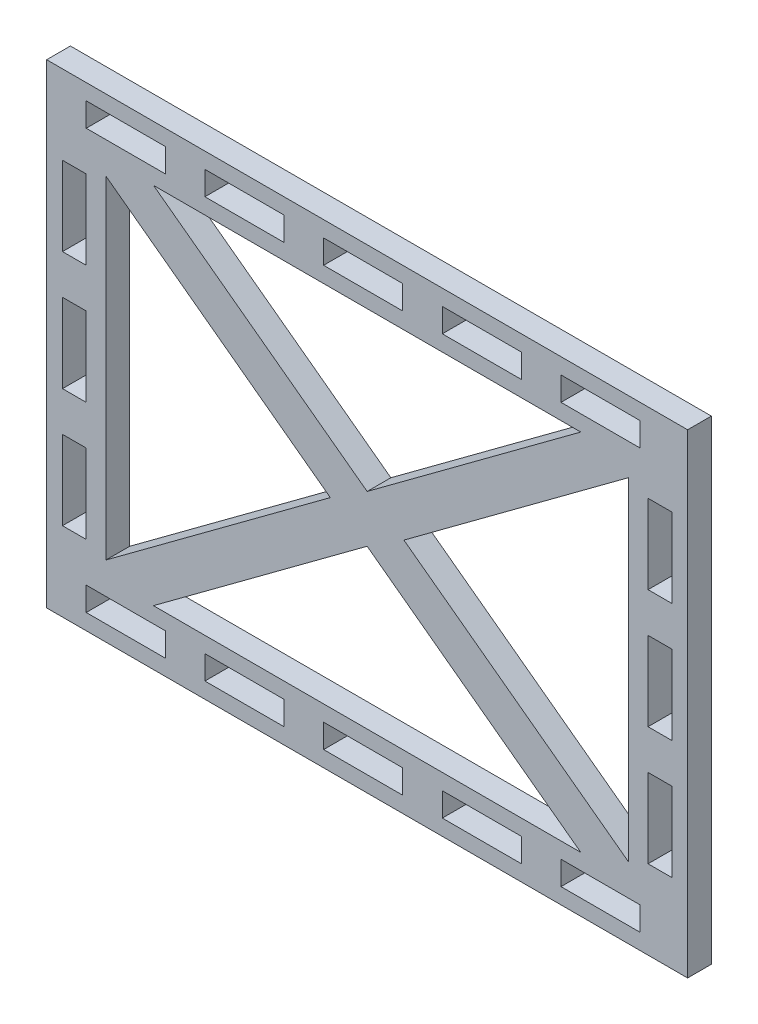
from build123d import *

# Parameters (mm, degrees)
SKETCH_1_W          = 81
SKETCH_1_H          = 60
SKETCH_1_W_2        = 10
SKETCH_1_H_2        = 3
SKETCH_1_W_3        = 3
SKETCH_1_H_3        = 10
EXTRUDE_1_DEPTH     = 3
CUT_EXTRUDE_1_DEPTH = 10


with BuildPart() as part:
    # 草图1 → 凸台-拉伸1 (new body)
    with BuildSketch(Plane.XY):
        Rectangle(SKETCH_1_W, SKETCH_1_H)
        with Locations((-30.5, 26.5)):
            Rectangle(SKETCH_1_W_2, SKETCH_1_H_2, mode=Mode.SUBTRACT)
        with Locations((-37, 15)):
            Rectangle(SKETCH_1_W_3, SKETCH_1_H_3, mode=Mode.SUBTRACT)
        with Locations((-37, 0)):
            Rectangle(SKETCH_1_W_3, SKETCH_1_H_3, mode=Mode.SUBTRACT)
        with Locations((-37, -15)):
            Rectangle(SKETCH_1_W_3, SKETCH_1_H_3, mode=Mode.SUBTRACT)
        with Locations((37, -15)):
            Rectangle(SKETCH_1_W_3, SKETCH_1_H_3, mode=Mode.SUBTRACT)
        with Locations((37, 0)):
            Rectangle(SKETCH_1_W_3, SKETCH_1_H_3, mode=Mode.SUBTRACT)
        with Locations((37, 15)):
            Rectangle(SKETCH_1_W_3, SKETCH_1_H_3, mode=Mode.SUBTRACT)
        with Locations((-15.5, 26.5)):
            Rectangle(SKETCH_1_W_2, SKETCH_1_H_2, mode=Mode.SUBTRACT)
        with Locations((-0.5, 26.5)):
            Rectangle(SKETCH_1_W_2, SKETCH_1_H_2, mode=Mode.SUBTRACT)
        with Locations((14.5, 26.5)):
            Rectangle(SKETCH_1_W_2, SKETCH_1_H_2, mode=Mode.SUBTRACT)
        with Locations((29.5, 26.5)):
            Rectangle(SKETCH_1_W_2, SKETCH_1_H_2, mode=Mode.SUBTRACT)
        with Locations((29.5, -26.5)):
            Rectangle(SKETCH_1_W_2, SKETCH_1_H_2, mode=Mode.SUBTRACT)
        with Locations((14.5, -26.5)):
            Rectangle(SKETCH_1_W_2, SKETCH_1_H_2, mode=Mode.SUBTRACT)
        with Locations((-0.5, -26.5)):
            Rectangle(SKETCH_1_W_2, SKETCH_1_H_2, mode=Mode.SUBTRACT)
        with Locations((-15.5, -26.5)):
            Rectangle(SKETCH_1_W_2, SKETCH_1_H_2, mode=Mode.SUBTRACT)
        with Locations((-30.5, -26.5)):
            Rectangle(SKETCH_1_W_2, SKETCH_1_H_2, mode=Mode.SUBTRACT)
    extrude(amount=EXTRUDE_1_DEPTH)

    # 草图2 → 切除-拉伸1 (cut)
    with BuildSketch(Plane.XY.offset(3)):
        Polygon((-27, 23), (27, 23), (0, 3), align=None)
        Polygon((-27, -23), (0, -3), (27, -23), align=None)
        Polygon((33, 21), (33, -21), (4.65, 0), align=None)
        Polygon((-33, 21), (-4.65, 0), (-33, -21), align=None)
    extrude(amount=-CUT_EXTRUDE_1_DEPTH, mode=Mode.SUBTRACT)


solid = part.part
